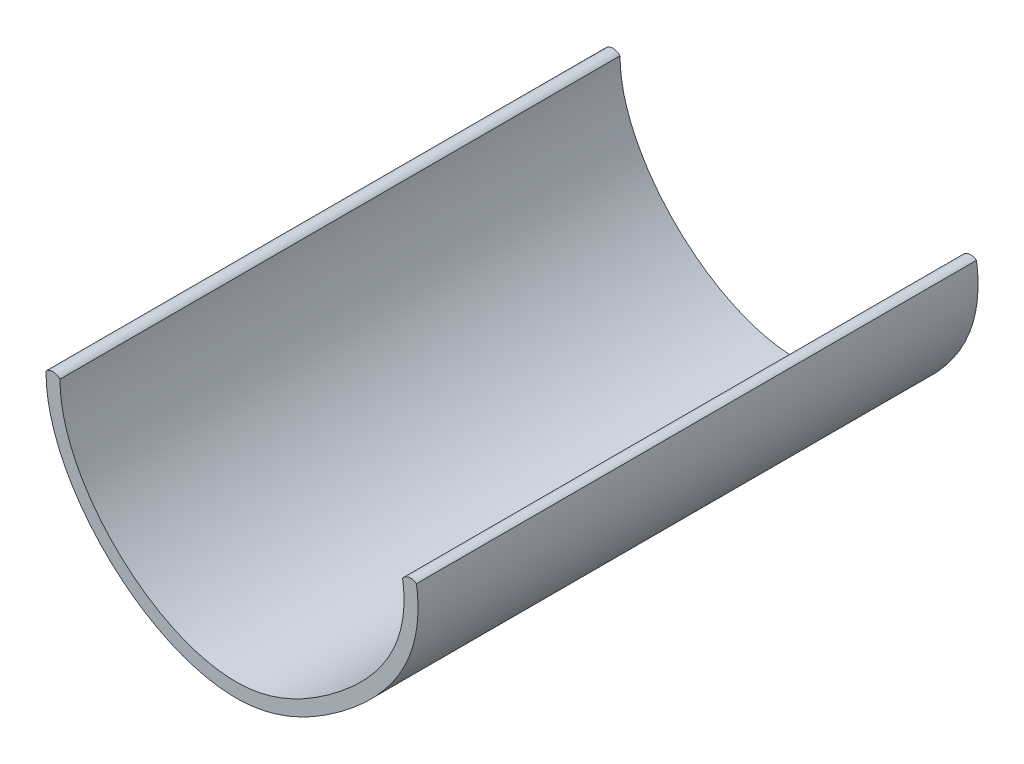
from build123d import *

# Parameters (mm, degrees)
BOSS_EXTRUDE1_DEPTH = 160


with BuildPart() as part:
    # Sketch1 → Boss-Extrude1 (new body)
    with BuildSketch(Plane.XY):
        with BuildLine():
            ThreePointArc((51.883290663, 0.299026981), (49.78191026, 0.819115344), (47.92825192, -0.299026981))
            add(Edge.make_bspline(
                [(47.92825192, -0.299026981), (48.056538033, -1.147406195), (48.255945865, -2.876925062), (48.393192087, -6.169668044), (48.118481917, -10.121491486), (47.134803167, -14.587954196), (45.031225662, -20.225794275), (41.048500658, -26.724961913), (34.557003303, -33.697587008), (26.855127526, -39.93598432), (18.528840904, -45.198175496), (9.7645181, -48.81199135), (0.809088458, -50.174047714), (-8.397845425, -49.058187868), (-20.564631211, -44.747329302), (-31.833752834, -36.75690054), (-40.746667664, -26.453558878), (-45.90624389, -17.929662792), (-48.657777136, -10.475994006), (-49.779445791, -4.471176946), (-49.95803907, -1.50683841), (-49.946009449, -0.016139041)],
                knots=[0, 0, 0, 0, 0.015625, 0.03125, 0.0625, 0.09375, 0.125, 0.1875, 0.25, 0.3125, 0.375, 0.4375, 0.5, 0.5625, 0.625, 0.75, 0.8125, 0.875, 0.9375, 0.96875, 1, 1, 1, 1], degree=3))
            ThreePointArc((-49.946009449, -0.016139041), (-51.939259322, 0.828400152), (-53.945879213, 0.016139041))
            add(Edge.make_bspline(
                [(-53.945879213, 0.016139041), (-53.972837277, -3.324479169), (-53.116919739, -9.97210814), (-48.318625741, -22.947699973), (-37.497781095, -37.65579608), (-22.536982732, -48.288965805), (-9.352978205, -52.978097527), (-0.87516708, -54.007232689), (5.884203443, -53.473766976), (12.495566089, -52.019317377), (20.412937664, -48.750122664), (29.216313832, -43.174417359), (37.255619912, -36.665746685), (44.226449634, -29.198356461), (48.622397109, -22.047480961), (50.983022757, -15.72780127), (52.092534992, -10.691047031), (52.401036315, -6.243191766), (52.246806921, -2.559895584), (52.025777011, -0.643260947), (51.883290663, 0.299026981)],
                knots=[0, 0, 0, 0, 0.0625, 0.125, 0.25, 0.375, 0.4375, 0.5, 0.53125, 0.5625, 0.625, 0.6875, 0.75, 0.8125, 0.875, 0.90625, 0.9375, 0.96875, 0.984375, 1, 1, 1, 1], degree=3))
        make_face()
    extrude(amount=BOSS_EXTRUDE1_DEPTH)


solid = part.part
